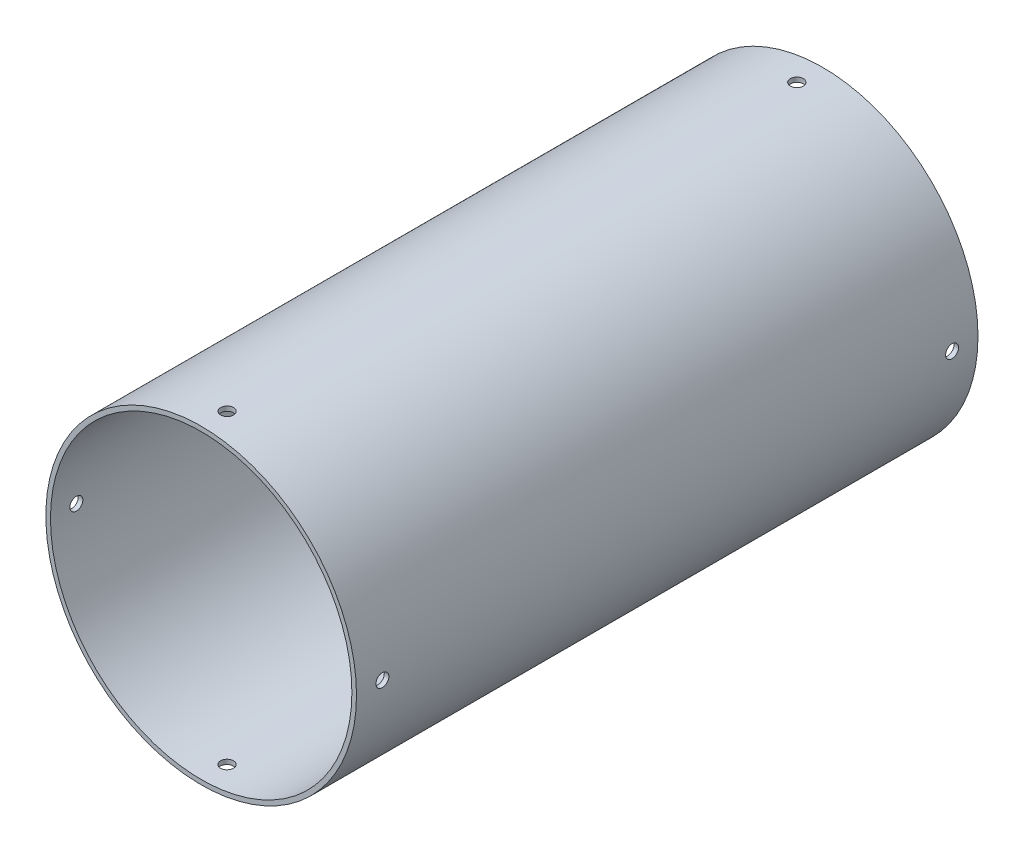
from build123d import *

# Parameters (mm, degrees)
SKETCH1_R           = 76.1746
SKETCH1_R_2         = 73.914
BOSS_EXTRUDE1_DEPTH = 304.8
SKETCH2_R           = 3.175
CUT_EXTRUDE1_DEPTH  = 25.4
CIRPATTERN1_COUNT   = 4


with BuildPart() as part:
    # Sketch1 → Boss-Extrude1 (new body)
    with BuildSketch(Plane.XY):
        with Locations(Location((0, 0, 0), (0, 0, 180))):
            Circle(SKETCH1_R)
        with Locations(Location((0, 0, 0), (0, 0, 180))):
            Circle(SKETCH1_R_2, mode=Mode.SUBTRACT)
    extrude(amount=BOSS_EXTRUDE1_DEPTH)

    # Sketch2 → Cut-Extrude1 (cut)
    with BuildSketch(Plane(origin=(76.2, 0, 0), x_dir=(0, 0, -1), z_dir=(1, 0, 0))):
        with Locations((-292.1, 0)):
            Circle(SKETCH2_R)
        with Locations((-12.7, 0)):
            Circle(SKETCH2_R)
    cut_extrude1 = extrude(amount=-CUT_EXTRUDE1_DEPTH, mode=Mode.SUBTRACT)

    # CirPattern1: Cut-Extrude1 ×4 about axis
    cirpattern1_axis = Axis((0, 0, 304.8), (0, 0, -1))
    for i in range(1, CIRPATTERN1_COUNT):
        add(cut_extrude1.rotate(cirpattern1_axis, i * 360 / CIRPATTERN1_COUNT), mode=Mode.SUBTRACT)


solid = part.part
